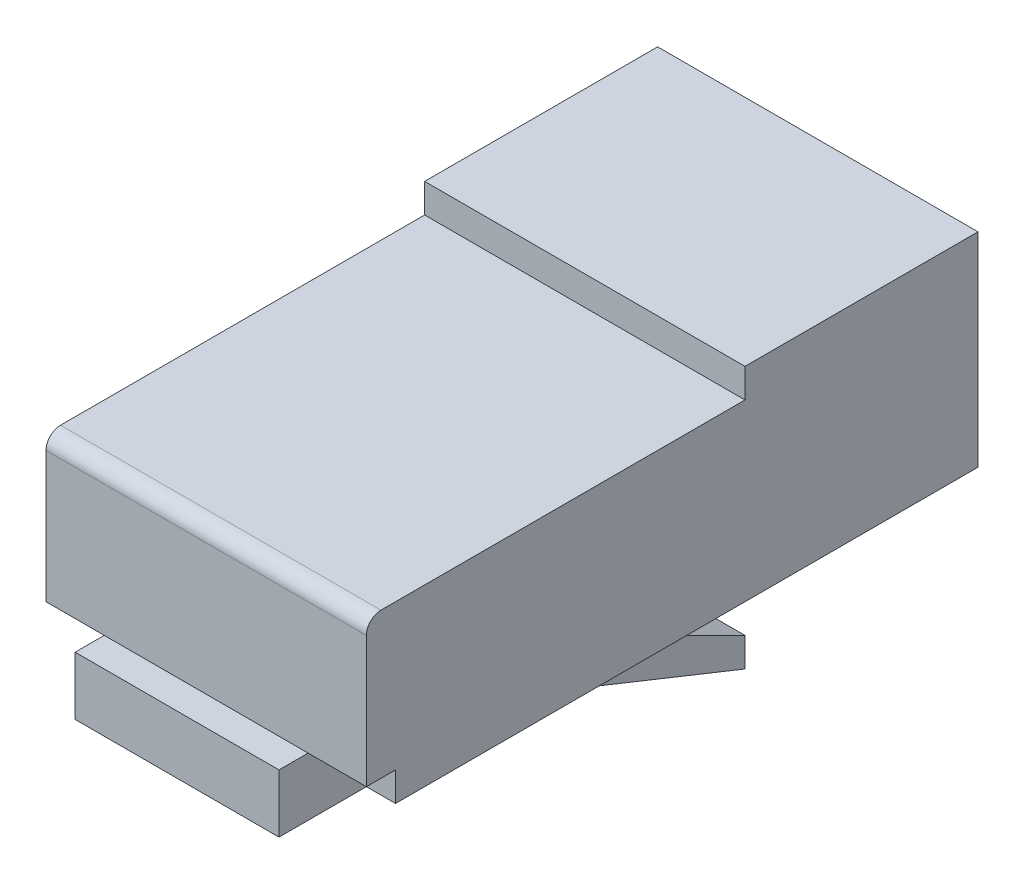
from build123d import *

# Parameters (mm, degrees)
SKETCH_2_W          = 11
SKETCH_2_H          = 6
EXTRUDE_1_DEPTH     = 5
SKETCH_3_W          = 11
SKETCH_3_H          = 6
EXTRUDE_2_DEPTH     = 8
SKETCH_4_W          = 11
SKETCH_4_H          = 7
EXTRUDE_3_DEPTH     = 8
SKETCH_6_W          = 7
SKETCH_6_H          = 2
EXTRUDE_4_DEPTH     = 1
SKETCH_8_W          = 2
SKETCH_8_H          = 1
CUT_EXTRUDE_1_DEPTH = 1
SKETCH_10_W         = 7
SKETCH_10_H         = 3
EXTRUDE_5_DEPTH     = 1
EXTRUDE_6_DEPTH     = 7
EXTRUDE_7_DEPTH     = 5
SKETCH_14_W         = 7
SKETCH_14_H         = 3
CUT_EXTRUDE_2_DEPTH = 8
FILLET_1_R          = 0.5


with BuildPart() as part:
    # Эскиз2 → Бобышка-Вытянуть1 (new body)
    with BuildSketch(Plane.XY):
        with Locations((5.5, 3)):
            Rectangle(SKETCH_2_W, SKETCH_2_H)
    extrude(amount=EXTRUDE_1_DEPTH)

    # Эскиз3 → Бобышка-Вытянуть2 (add)
    with BuildSketch(Plane(origin=(0, 0, 0), x_dir=(-1, 0, 0), z_dir=(0, 0, -1))):
        with Locations((-5.5, 3)):
            Rectangle(SKETCH_3_W, SKETCH_3_H)
    extrude(amount=EXTRUDE_2_DEPTH)

    # Эскиз4 → Бобышка-Вытянуть3 (add)
    with BuildSketch(Plane(origin=(0, 0, -8), x_dir=(-1, 0, 0), z_dir=(0, 0, -1))):
        with Locations((-5.5, 3.5)):
            Rectangle(SKETCH_4_W, SKETCH_4_H)
    extrude(amount=EXTRUDE_3_DEPTH)

    # Эскиз6 → Бобышка-Вытянуть4 (add)
    with BuildSketch(Plane.XY.offset(5)):
        with Locations((5.5, 0)):
            Rectangle(SKETCH_6_W, SKETCH_6_H)
    extrude(amount=EXTRUDE_4_DEPTH)

    # Эскиз8 → Вырез-Вытянуть1 (cut)
    with BuildSketch(Plane.XY.offset(5)):
        with Locations((1, 0.5)):
            Rectangle(SKETCH_8_W, SKETCH_8_H)
        with Locations((10, 0.5)):
            Rectangle(SKETCH_8_W, SKETCH_8_H)
    extrude(amount=-CUT_EXTRUDE_1_DEPTH, mode=Mode.SUBTRACT)

    # Эскиз10 → Бобышка-Вытянуть5 (add)
    with BuildSketch(Plane.XZ):
        with Locations((5.5, 3.5)):
            Rectangle(SKETCH_10_W, SKETCH_10_H)
    extrude(amount=EXTRUDE_5_DEPTH)

    # Эскиз12 → Бобышка-Вытянуть6 (add)
    with BuildSketch(Plane(origin=(9, 0, 0), x_dir=(0, 0, -1), z_dir=(1, 0, 0))):
        Polygon((-2, 0), (1, -0.5), (1, -2), (0, -1.5), (-2, -1), align=None)
    extrude(amount=-EXTRUDE_6_DEPTH)

    # Эскиз13 → Бобышка-Вытянуть7 (add)
    with BuildSketch(Plane(origin=(8, 0, 0), x_dir=(0, 0, -1), z_dir=(1, 0, 0))):
        Polygon((1, -0.5), (6, -1.5), (11, -4), (11, -5), (6, -3), (1, -2), align=None)
    extrude(amount=-EXTRUDE_7_DEPTH)

    # Эскиз14 → Вырез-Вытянуть2 (cut)
    with BuildSketch(Plane(origin=(0, 0, -16), x_dir=(-1, 0, 0), z_dir=(0, 0, -1))):
        with Locations((-5.5, 3.5)):
            Rectangle(SKETCH_14_W, SKETCH_14_H)
    extrude(amount=-CUT_EXTRUDE_2_DEPTH, mode=Mode.SUBTRACT)

    # Скругление1
    fillet_1_edges = [part.edges().sort_by_distance(p)[0] for p in [
        (5.5, 6, 5),
    ]]
    fillet(fillet_1_edges, radius=FILLET_1_R)


solid = part.part
